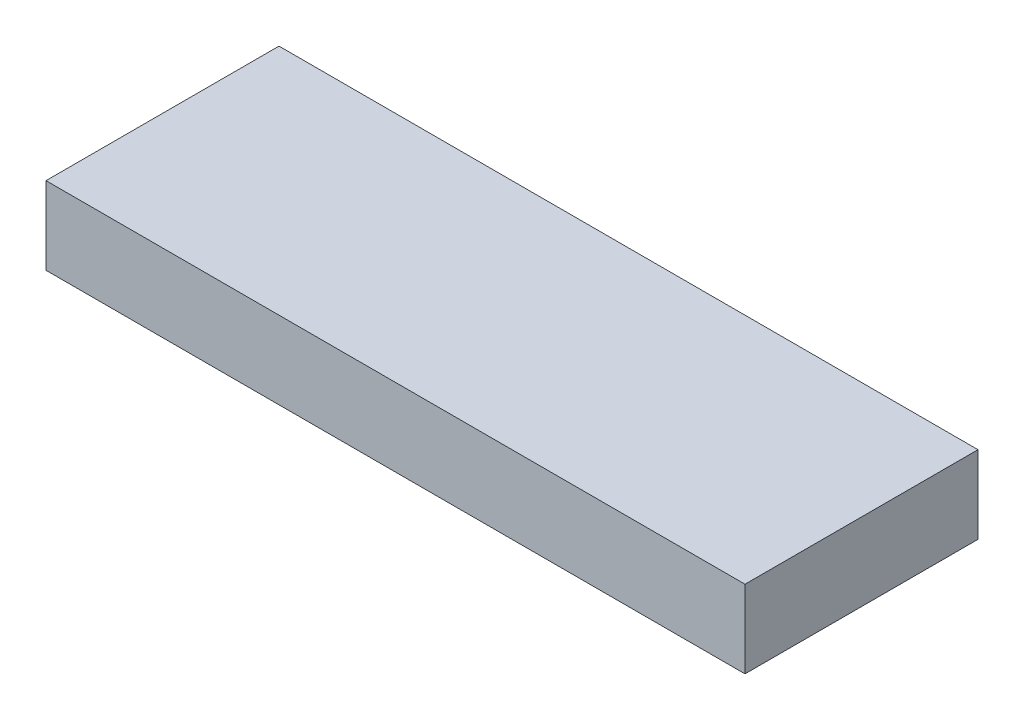
from build123d import *

# Parameters (mm, degrees)
SKETCH1_W           = 90
SKETCH1_H           = 30
BOSS_EXTRUDE1_DEPTH = 10


with BuildPart() as part:
    # Sketch1 → Boss-Extrude1 (new body)
    with BuildSketch(Plane(origin=(0, 0, 0), x_dir=(1, 0, 0), z_dir=(0, 1, 0))):
        Rectangle(SKETCH1_W, SKETCH1_H)
    extrude(amount=BOSS_EXTRUDE1_DEPTH)


solid = part.part
